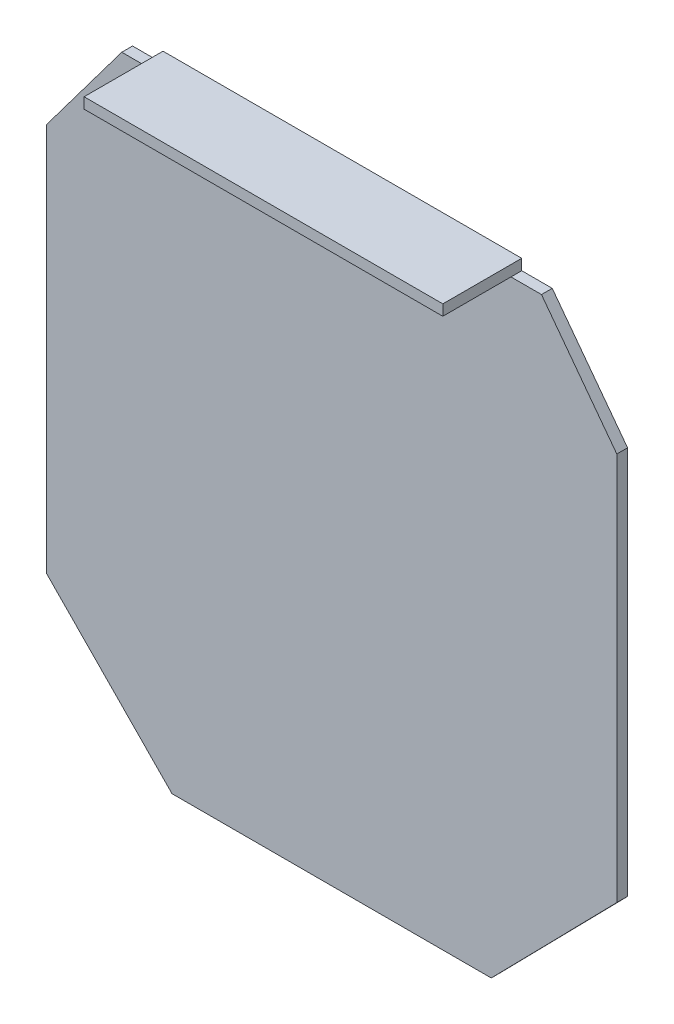
from build123d import *

# Parameters (mm, degrees)
BOSS_EXTRUDE1_DEPTH = 3
SKETCH3_W           = 100
SKETCH3_H           = 22
BOSS_EXTRUDE2_DEPTH = 3


with BuildPart() as part:
    # Sketch1 → Boss-Extrude1 (new body)
    with BuildSketch(Plane.XY):
        Polygon((-79.5, 58), (-79.5, -50.292857857), (-44.5, -86), (44.5, -86), (79.5, -50.292857857), (79.5, 58), (58.5, 86), (-58.5, 86), align=None)
    extrude(amount=BOSS_EXTRUDE1_DEPTH)

    # Sketch3 → Boss-Extrude2 (add)
    with BuildSketch(Plane(origin=(0, 86, 0), x_dir=(1, 0, 0), z_dir=(0, 1, 0))):
        with Locations((0, -11)):
            Rectangle(SKETCH3_W, SKETCH3_H)
    extrude(amount=BOSS_EXTRUDE2_DEPTH)


solid = part.part
